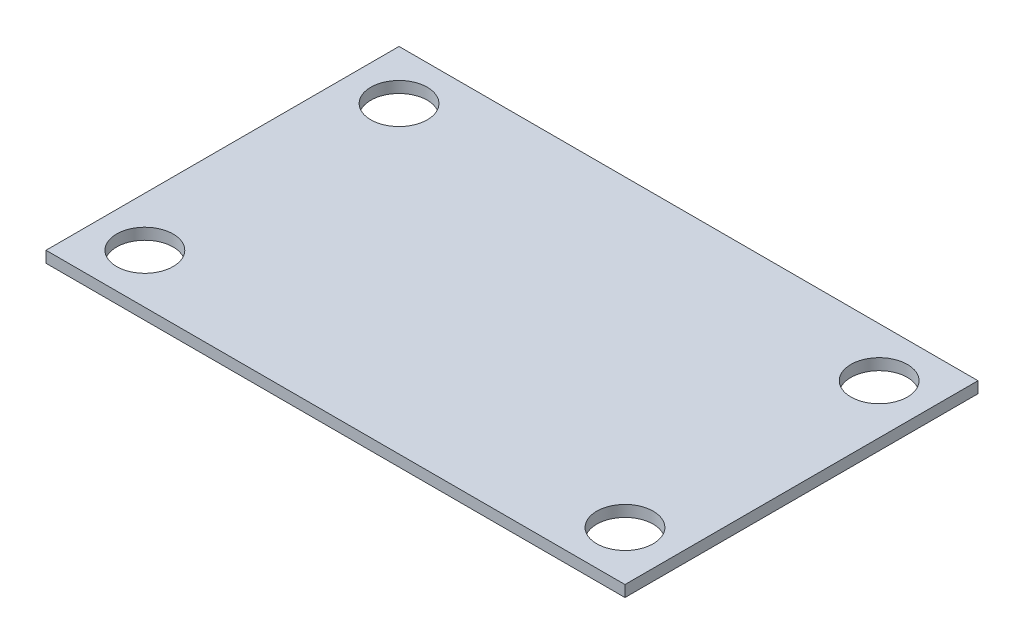
from build123d import *

# Parameters (mm, degrees)
SKETCH_1_W      = 82
SKETCH_1_H      = 50
SKETCH_1_R      = 4
EXTRUDE_1_DEPTH = 1.6


with BuildPart() as part:
    # 草图1 → 凸台-拉伸1 (new body)
    with BuildSketch(Plane(origin=(0, 0, 0), x_dir=(1, 0, 0), z_dir=(0, 1, 0))):
        Rectangle(SKETCH_1_W, SKETCH_1_H)
        with Locations(Location((-34, -18, 0), (0, 0, 270))):
            Circle(SKETCH_1_R, mode=Mode.SUBTRACT)
        with Locations(Location((34, -18, 0), (0, 0, 90))):
            Circle(SKETCH_1_R, mode=Mode.SUBTRACT)
        with Locations(Location((34, 18, 0), (0, 0, 270))):
            Circle(SKETCH_1_R, mode=Mode.SUBTRACT)
        with Locations(Location((-34, 18, 0), (0, 0, 90))):
            Circle(SKETCH_1_R, mode=Mode.SUBTRACT)
    extrude(amount=EXTRUDE_1_DEPTH)


solid = part.part
